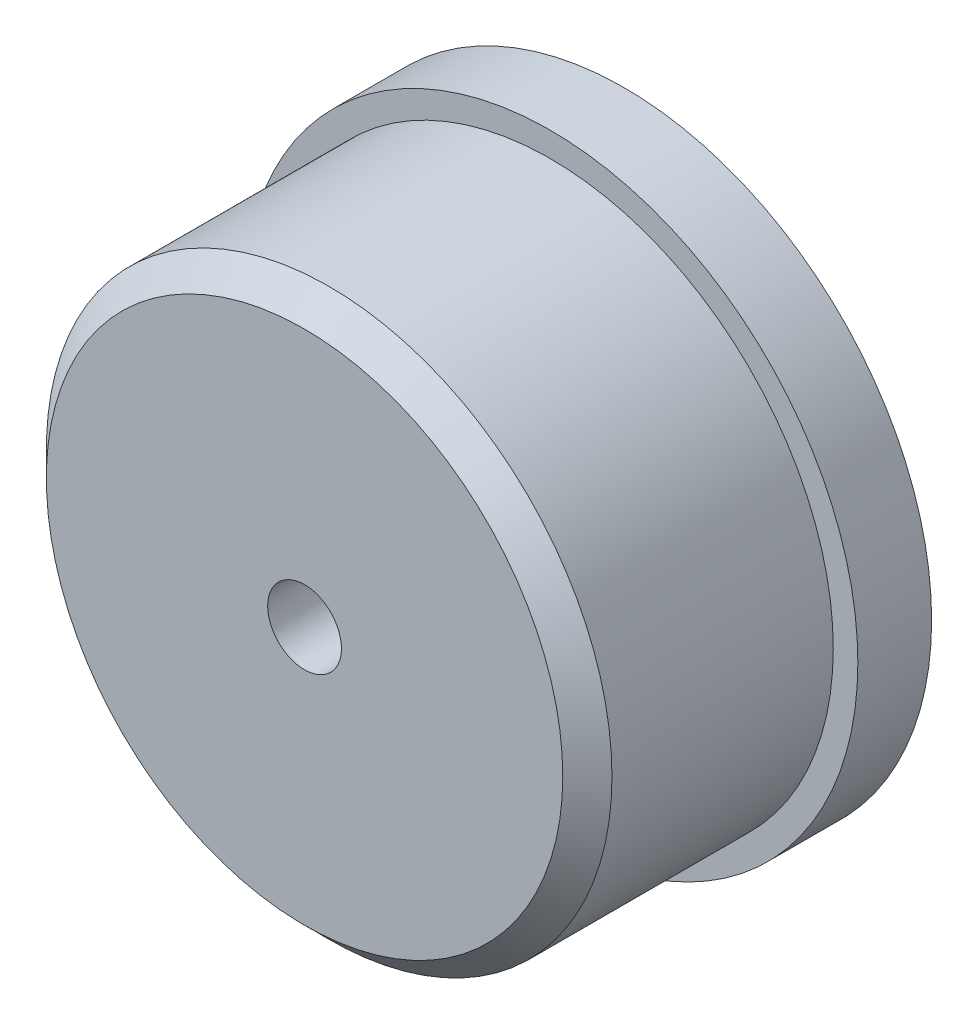
from build123d import *

# Parameters (mm, degrees)
ESQUISSE1_R       = 12.5
EXTRUSION1_DEPTH  = 3
ESQUISSE2_R       = 11.5
EXTRUSION2_DEPTH  = 10
CHANFREIN1_SIZE   = 1
TROU_TARAUD_M41_D = 3


with BuildPart() as part:
    # Esquisse1 → Extrusion1 (new body)
    with BuildSketch(Plane.XY):
        Circle(ESQUISSE1_R)
    extrude(amount=EXTRUSION1_DEPTH)

    # Esquisse2 → Extrusion2 (add)
    with BuildSketch(Plane.XY.offset(3)):
        Circle(ESQUISSE2_R)
    extrude(amount=EXTRUSION2_DEPTH)

    # Chanfrein1
    chanfrein1_edges = [part.edges().sort_by_distance(p)[0] for p in [
        (-11.5, 0, 13),
    ]]
    chamfer(chanfrein1_edges, length=CHANFREIN1_SIZE)

    # Trou taraudé M41 (through all)
    with Locations(Plane(origin=(0, 0, 0), x_dir=(-1, 0, 0), z_dir=(0, 0, -1))):
        with Locations((0, 0)):
            Hole(TROU_TARAUD_M41_D / 2)


solid = part.part
